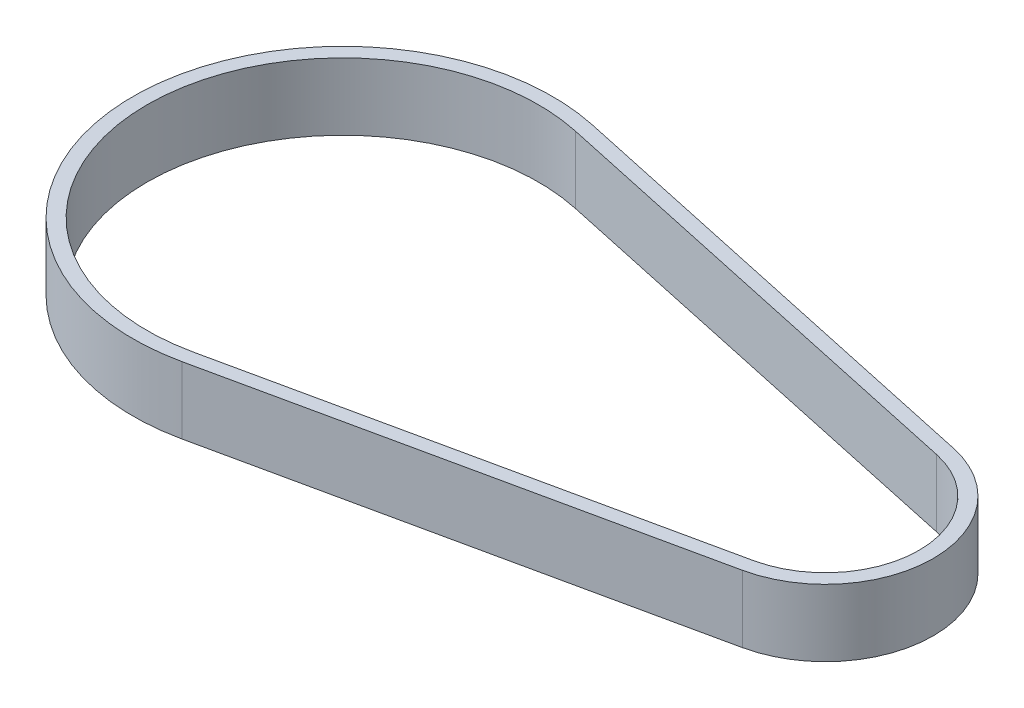
from build123d import *

# Parameters (mm, degrees)
BOSS_EXTRUDE1_DEPTH = 25


with BuildPart() as part:
    # Sketch1 → Boss-Extrude1 (new body)
    with BuildSketch(Plane(origin=(0, 0, 0), x_dir=(1, 0, 0), z_dir=(0, 1, 0))):
        with BuildLine():
            Line((16.53, 76.5352801), (188.507777778, 39.391721431))
            ThreePointArc((188.507777778, 39.391721431), (220.3, 0), (188.507777778, -39.391721431))
            Line((188.507777778, -39.391721431), (16.53, -76.5352801))
            ThreePointArc((16.53, -76.5352801), (-78.3, 0), (16.53, 76.5352801))
        make_face()
        with BuildLine():
            Line((15.411111111, -71.354731128), (187.388888889, -34.211172459))
            ThreePointArc((187.388888889, -34.211172459), (215, 0), (187.388888889, 34.211172459))
            Line((187.388888889, 34.211172459), (15.411111111, 71.354731128))
            ThreePointArc((15.411111111, 71.354731128), (-73, 0), (15.411111111, -71.354731128))
        make_face(mode=Mode.SUBTRACT)
    extrude(amount=BOSS_EXTRUDE1_DEPTH)


solid = part.part
